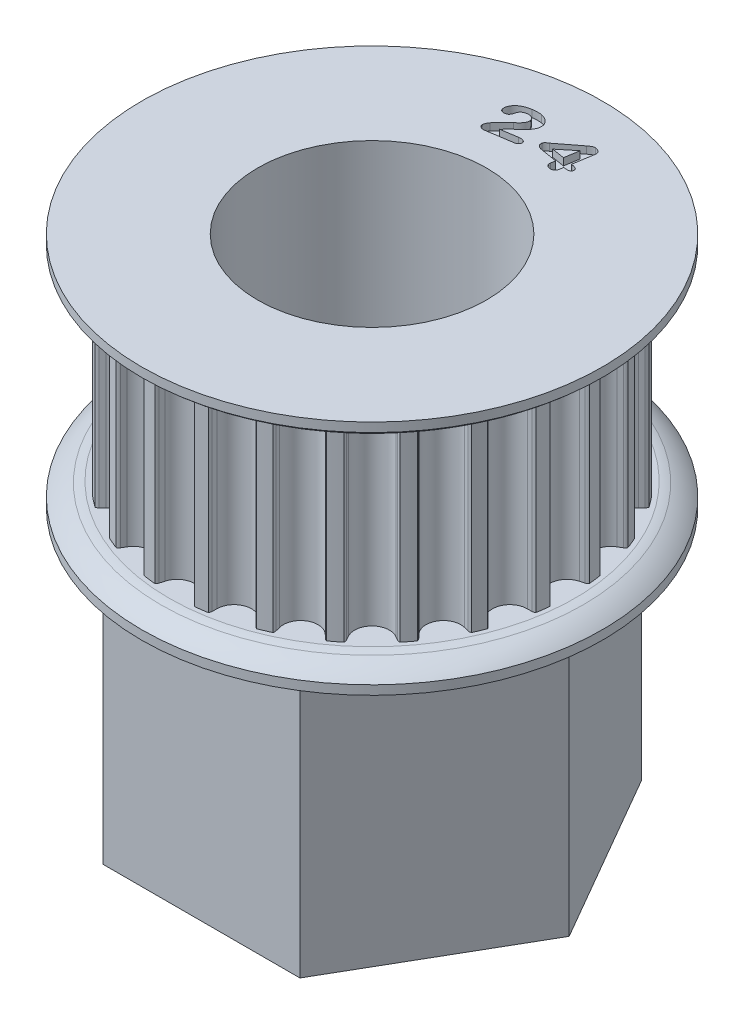
from build123d import *

# Parameters (mm, degrees)
SKETCH1_R                    = 11.078156269
TOOTHOD_DEPTH                = 5.334
TOOTHPROFILE_DEPTH           = 17.550004491
TOOTHPATTERN_COUNT           = 24
BORE_DEPTH                   = 20.343586122
BORE_DEPTH_BACK              = 20.343586122
SKETCH7_R                    = 6.3881
SMALL_TOOTH_COUNT_DEPTH      = 23.472489227
SMALL_TOOTH_COUNT_DEPTH_BACK = 0.4
SKETCH12_R                   = 6.3881
BOSS_EXTRUDE1_DEPTH          = 15.24


with BuildPart() as part:
    # Sketch1 → ToothOD (new, symmetric)
    with BuildSketch(Plane(origin=(0, 0, 0), x_dir=(1, 0, 0), z_dir=(0, 1, 0))):
        Circle(SKETCH1_R)
    extrude(amount=TOOTHOD_DEPTH, both=True)

    # Sketch2 → ToothProfile (cut, symmetric)
    with BuildSketch(Plane(origin=(0, 0, 0), x_dir=(1, 0, 0), z_dir=(0, 1, 0))):
        with BuildLine():
            ThreePointArc((-0.937033068, 10.628218265), (-0.590385173, 10.110043655), (0, 9.909756269))
            ThreePointArc((0, 9.909756269), (0.590385173, 10.110043655), (0.937033068, 10.628218265))
            ThreePointArc((0.937033068, 10.628218265), (0.971699064, 10.754329727), (1.007805813, 10.880036269))
            ThreePointArc((1.007805813, 10.880036269), (1.043742495, 10.958436311), (1.100516181, 11.023357495))
            ThreePointArc((1.100516181, 11.023357495), (0, 11.078156269), (-1.100516181, 11.023357495))
            ThreePointArc((-1.100516181, 11.023357495), (-1.043742495, 10.958436311), (-1.007805813, 10.880036269))
            ThreePointArc((-1.007805813, 10.880036269), (-0.971699064, 10.754329727), (-0.937033068, 10.628218265))
        make_face()
    toothprofile = extrude(amount=TOOTHPROFILE_DEPTH, both=True, mode=Mode.SUBTRACT)

    # ToothPattern: ToothProfile ×24 about axis
    toothpattern_axis = Axis((0, 5.334, 0), (0, -1, 0))
    for i in range(1, TOOTHPATTERN_COUNT):
        add(toothprofile.rotate(toothpattern_axis, i * 360 / TOOTHPATTERN_COUNT), mode=Mode.SUBTRACT)

    # Sketch4 → Flange (revolve)
    with BuildSketch(Plane.XY):
        with BuildLine():
            Line((0, -5.334), (11.332156269, -5.334))
            ThreePointArc((11.332156269, -5.334), (11.56180289, -5.369951298), (11.787228598, -5.426637424))
            ThreePointArc((11.787228598, -5.426637424), (12.354957174, -5.708197125), (12.856156269, -6.096))
            Line((12.856156269, -6.096), (12.856156269, -6.604))
            Line((12.856156269, -6.604), (0, -6.604))
            Line((0, -6.604), (0, -5.334))
        make_face()
        with BuildLine():
            Line((12.856156269, 6.604), (12.856156269, 6.096))
            ThreePointArc((12.856156269, 6.096), (12.354957174, 5.708197125), (11.787228598, 5.426637424))
            ThreePointArc((11.787228598, 5.426637424), (11.56180289, 5.369951298), (11.332156269, 5.334))
            Line((11.332156269, 5.334), (0, 5.334))
            Line((0, 5.334), (0, 6.604))
            Line((0, 6.604), (12.856156269, 6.604))
        make_face()
    revolve(axis=Axis((0, 8.73125, 0), (0, -1, 0)))

    # Sketch7 → Bore (cut, two sides: drawn at the far end of the back side and taken through both)
    with BuildSketch(Plane.XZ.offset(-BORE_DEPTH_BACK)):
        Circle(SKETCH7_R)
    extrude(amount=BORE_DEPTH + BORE_DEPTH_BACK, mode=Mode.SUBTRACT)

    # Sketch11 → Small Tooth Count (cut, two sides: drawn at the far end of the back side and taken through both)
    # profile 1 of 2: a face of its own
    with BuildSketch(Plane(origin=(0, 6.604, 0), x_dir=(1, 0, 0), z_dir=(0, 1, 0)).offset(-SMALL_TOOTH_COUNT_DEPTH_BACK)):
        with BuildLine():
            Line((-1.506669992, 8.621605484), (-0.594948898, 8.761801578))
            add(Edge.make_bspline(
                [(-0.594948898, 8.761801578), (-0.568508634, 8.765198423), (-0.51843609, 8.771631365), (-0.44654772, 8.772071074), (-0.382615431, 8.763265759), (-0.327096583, 8.746782768), (-0.28073736, 8.722976742), (-0.245229797, 8.692438756), (-0.219549143, 8.656177692), (-0.213233627, 8.628356784), (-0.210079367, 8.614461734)],
                knots=[0, 0, 0, 0, 1.405872796, 2.662440438, 3.780874982, 4.799416848, 5.705812893, 6.507413553, 7.254533237, 8, 8, 8, 8], degree=3))
            add(Edge.make_bspline(
                [(-0.210079367, 8.614461734), (-0.208889964, 8.601771408), (-0.206493047, 8.576197502), (-0.216741472, 8.537560395), (-0.235628299, 8.499855984), (-0.26391302, 8.463095811), (-0.302942444, 8.429662764), (-0.353193783, 8.402600281), (-0.413829448, 8.381641212), (-0.458320193, 8.373612775), (-0.481988351, 8.369341812)],
                knots=[0, 0, 0, 0, 0.747692017, 1.506770081, 2.320581731, 3.22962232, 4.226992794, 5.332726267, 6.581065457, 8, 8, 8, 8], degree=3))
            Line((-0.481988351, 8.369341812), (-1.850909445, 8.159494156))
            add(Edge.make_bspline(
                [(-1.850909445, 8.159494156), (-1.874677499, 8.156558384), (-1.920064022, 8.15095235), (-1.985993536, 8.153953423), (-2.045566646, 8.166819623), (-2.097937256, 8.188882133), (-2.141644576, 8.218958806), (-2.176056266, 8.25450227), (-2.200261447, 8.296079566), (-2.206948594, 8.326650658), (-2.210329367, 8.342106266)],
                knots=[0, 0, 0, 0, 1.280086864, 2.444402485, 3.513161164, 4.526674079, 5.465738593, 6.33344229, 7.157450346, 8, 8, 8, 8], degree=3))
            add(Edge.make_bspline(
                [(-2.210329367, 8.342106266), (-2.211321429, 8.35297506), (-2.213474856, 8.376567494), (-2.207871102, 8.414736071), (-2.197602748, 8.457816322), (-2.181066772, 8.504044131), (-2.161523691, 8.550563815), (-2.139011673, 8.59387946), (-2.114771053, 8.632517333), (-2.096113828, 8.655263986), (-2.087099679, 8.666253922)],
                knots=[0, 0, 0, 0, 0.73683643, 1.599419737, 2.594339727, 3.735396803, 4.918497864, 6.009402824, 7.038252518, 8, 8, 8, 8], degree=3))
            add(Edge.make_bspline(
                [(-2.087099679, 8.666253922), (-2.051926797, 8.70563464), (-1.983635312, 8.782096037), (-1.882781696, 8.891706347), (-1.787421488, 8.993402689), (-1.71040015, 9.071642309), (-1.653062288, 9.130098592), (-1.613191617, 9.168811361), (-1.576609875, 9.204115545), (-1.543103636, 9.235957396), (-1.512499045, 9.26401221), (-1.484693768, 9.288140763), (-1.460222689, 9.308797929), (-1.444641349, 9.320989249), (-1.437464914, 9.326604312)],
                knots=[0, 0, 0, 0, 2.05005439, 3.980374895, 5.783081705, 7.462550166, 8.242986023, 8.962167681, 9.620127169, 10.216906376, 10.75681469, 11.231916014, 11.646236775, 12, 12, 12, 12], degree=3))
            add(Edge.make_bspline(
                [(-1.437464914, 9.326604312), (-1.415699138, 9.344096052), (-1.373639167, 9.377896918), (-1.31556485, 9.430556423), (-1.263091792, 9.481497265), (-1.217417118, 9.532268382), (-1.177355276, 9.581870506), (-1.143339078, 9.630659742), (-1.115770383, 9.678955907), (-1.094008941, 9.726222335), (-1.079010073, 9.772608594), (-1.068990971, 9.817254636), (-1.066125276, 9.860516575), (-1.069031756, 9.888447706), (-1.070454757, 9.902122672)],
                knots=[0, 0, 0, 0, 1.412730359, 2.729946272, 3.965505171, 5.111982469, 6.183504339, 7.190458038, 8.118071664, 8.994433913, 9.818491729, 10.580687815, 11.305110666, 12, 12, 12, 12], degree=3))
            add(Edge.make_bspline(
                [(-1.070454757, 9.902122672), (-1.073101852, 9.915947961), (-1.078327528, 9.943240708), (-1.094494112, 9.981703166), (-1.116615509, 10.017043528), (-1.145060228, 10.04859137), (-1.178300901, 10.076950508), (-1.216302468, 10.101048218), (-1.258889714, 10.120303405), (-1.305215474, 10.134908931), (-1.354364351, 10.144457895), (-1.405333989, 10.149506523), (-1.457750016, 10.149178642), (-1.492860178, 10.144637273), (-1.510688351, 10.142331266)],
                knots=[0, 0, 0, 0, 0.907302037, 1.791120925, 2.676768316, 3.589403735, 4.523810352, 5.492033175, 6.485886253, 7.534944553, 8.622934081, 9.714528692, 10.839487572, 12, 12, 12, 12], degree=3))
            add(Edge.make_bspline(
                [(-1.510688351, 10.142331266), (-1.527596498, 10.139296406), (-1.560826651, 10.133331894), (-1.608260799, 10.117909964), (-1.652483903, 10.098012849), (-1.693864274, 10.074084955), (-1.731680005, 10.044484021), (-1.76651825, 10.010598615), (-1.798089169, 9.971893058), (-1.815934823, 9.943404547), (-1.825013351, 9.928911734)],
                knots=[0, 0, 0, 0, 1.046472807, 2.056668438, 3.031518194, 3.999586305, 4.963434377, 5.951707826, 6.95798289, 8, 8, 8, 8], degree=3))
            add(Edge.make_bspline(
                [(-1.825013351, 9.928911734), (-1.826559277, 9.925360904), (-1.831340104, 9.91437984), (-1.837656207, 9.890979564), (-1.847717966, 9.855611617), (-1.859566069, 9.81054411), (-1.873864818, 9.760908096), (-1.893574508, 9.713288417), (-1.916666393, 9.669565796), (-1.942422798, 9.628901741), (-1.976575179, 9.593383256), (-2.021136356, 9.565627073), (-2.075687033, 9.545210856), (-2.115811032, 9.537738725), (-2.137105929, 9.533773062)],
                knots=[0, 0, 0, 0, 0.255611913, 0.790488512, 1.596709105, 2.686601655, 3.868395343, 5.00580505, 6.083210694, 7.132990612, 8.175842434, 9.3076298, 10.571085967, 12, 12, 12, 12], degree=3))
            add(Edge.make_bspline(
                [(-2.137105929, 9.533773062), (-2.153754851, 9.531867902), (-2.186007077, 9.528177233), (-2.23368108, 9.532108784), (-2.278463536, 9.542658983), (-2.31955032, 9.560810626), (-2.355603746, 9.586270992), (-2.383667544, 9.619490715), (-2.403753934, 9.659477168), (-2.40984827, 9.688934956), (-2.413033273, 9.704330094)],
                knots=[0, 0, 0, 0, 1.103119517, 2.136958887, 3.137057405, 4.125913058, 5.082313969, 6.022605602, 6.966580255, 8, 8, 8, 8], degree=3))
            add(Edge.make_bspline(
                [(-2.413033273, 9.704330094), (-2.415009696, 9.722614032), (-2.419038371, 9.759883408), (-2.41588734, 9.817423499), (-2.405366179, 9.876857396), (-2.387446287, 9.937809803), (-2.362210558, 9.998975276), (-2.32919863, 10.0590732), (-2.288238244, 10.117088054), (-2.239926945, 10.173568432), (-2.18329972, 10.227352379), (-2.118289715, 10.277709516), (-2.044964572, 10.324806196), (-1.963139928, 10.367987482), (-1.872740102, 10.406840276), (-1.773817701, 10.440289158), (-1.666292684, 10.467537519), (-1.591307924, 10.480391675), (-1.552657882, 10.487017203)],
                knots=[0, 0, 0, 0, 0.686274673, 1.398879655, 2.144007501, 2.9376906, 3.768012583, 4.611728168, 5.494195759, 6.417073659, 7.384708564, 8.407017315, 9.485272479, 10.637082362, 11.860187496, 13.158039043, 14.535143527, 16, 16, 16, 16], degree=3))
            add(Edge.make_bspline(
                [(-1.552657882, 10.487017203), (-1.52841577, 10.490420955), (-1.480751914, 10.497113273), (-1.410338577, 10.504749177), (-1.342432419, 10.509701208), (-1.277046262, 10.51204123), (-1.214045238, 10.511479586), (-1.153411338, 10.508973664), (-1.095114995, 10.503782012), (-1.05733219, 10.497930911), (-1.038754367, 10.495053922)],
                knots=[0, 0, 0, 0, 1.138402681, 2.238281105, 3.293071229, 4.304174642, 5.280103653, 6.222317189, 7.125912474, 8, 8, 8, 8], degree=3))
            add(Edge.make_bspline(
                [(-1.038754367, 10.495053922), (-1.012752892, 10.489369266), (-0.96200432, 10.478274198), (-0.888985545, 10.45489373), (-0.821106831, 10.425791147), (-0.75796727, 10.391965838), (-0.700394534, 10.353338936), (-0.647860502, 10.311763872), (-0.60189878, 10.265513926), (-0.561703519, 10.21630272), (-0.52825955, 10.16388857), (-0.500935533, 10.109658948), (-0.481526714, 10.052937679), (-0.474093975, 10.014001671), (-0.470379757, 9.994544937)],
                knots=[0, 0, 0, 0, 1.187267261, 2.317257711, 3.41519456, 4.479015239, 5.508703171, 6.505479901, 7.463513324, 8.412595886, 9.335595681, 10.232590248, 11.116806744, 12, 12, 12, 12], degree=3))
            add(Edge.make_bspline(
                [(-0.470379757, 9.994544937), (-0.468313859, 9.979241775), (-0.464214985, 9.948879331), (-0.463028656, 9.902976173), (-0.465763305, 9.85759698), (-0.472017419, 9.812321869), (-0.482311465, 9.767549639), (-0.496288954, 9.722898988), (-0.514091815, 9.678640488), (-0.543276505, 9.621627388), (-0.5821308, 9.554514276), (-0.631232404, 9.480877647), (-0.681592679, 9.416301746), (-0.726197052, 9.368271741), (-0.764793863, 9.33139352), (-0.797639899, 9.300077015), (-0.835761225, 9.26560612), (-0.877842806, 9.226250562), (-0.924928843, 9.183462306), (-0.976268817, 9.136246595), (-1.032855305, 9.085860231), (-1.092257956, 9.032453687), (-1.15175781, 8.978868961), (-1.207750431, 8.927106786), (-1.258421687, 8.87803841), (-1.304564576, 8.832351062), (-1.346165344, 8.790274212), (-1.382469769, 8.750659594), (-1.414153642, 8.714540455), (-1.432796387, 8.690739083), (-1.441483273, 8.679648453)],
                knots=[0, 0, 0, 0, 0.765164555, 1.518135043, 2.272081093, 3.017164573, 3.78151037, 4.54699507, 5.334877641, 6.143361033, 7.720335075, 9.177470953, 10.528127201, 11.776029629, 12.423102498, 13.17473405, 14.025995043, 14.971095859, 16.031319452, 17.180387881, 18.429249831, 19.78780431, 21.140877121, 22.399207521, 23.568147666, 24.637778838, 25.618752723, 26.501291816, 27.301652942, 28, 28, 28, 28], degree=3))
            add(Edge.make_bspline(
                [(-1.441483273, 8.679648453), (-1.451024119, 8.669362064), (-1.470895109, 8.64793831), (-1.494433375, 8.630612493), (-1.506669992, 8.621605484)],
                knots=[0, 0, 0, 0, 0.960278846, 2, 2, 2, 2], degree=3))
        make_face()
    # profile 2 of 2: a face of its own
    with BuildSketch(Plane(origin=(0, 6.604, 0), x_dir=(1, 0, 0), z_dir=(0, 1, 0)).offset(-SMALL_TOOTH_COUNT_DEPTH_BACK)):
        with BuildLine():
            Line((1.55101935, 8.418337433), (1.58986349, 8.657206573))
            Line((1.58986349, 8.657206573), (0.687072084, 8.804099933))
            add(Edge.make_bspline(
                [(0.687072084, 8.804099933), (0.672000892, 8.806741232), (0.642738196, 8.811869661), (0.600810489, 8.822399788), (0.561659252, 8.833606125), (0.526052232, 8.847723884), (0.49325817, 8.862566946), (0.463946389, 8.879844481), (0.437487068, 8.898471155), (0.414229874, 8.918944931), (0.394394887, 8.941043653), (0.3777235, 8.964388587), (0.364276625, 8.988924673), (0.354172911, 9.014710713), (0.348258344, 9.041703291), (0.344382255, 9.06962205), (0.344406118, 9.09891493), (0.347202432, 9.118597173), (0.348636928, 9.128694073)],
                knots=[0, 0, 0, 0, 1.38782965, 2.694653257, 3.920845065, 5.079439636, 6.166911603, 7.183666584, 8.161659764, 9.099192842, 9.988512293, 10.850339669, 11.696364112, 12.521436542, 13.353442013, 14.197632313, 15.075393629, 16, 16, 16, 16], degree=3))
            add(Edge.make_bspline(
                [(0.348636928, 9.128694073), (0.351090473, 9.140034839), (0.356004071, 9.162746447), (0.37336919, 9.194608637), (0.397597542, 9.224376541), (0.427253538, 9.253217688), (0.460197633, 9.280208705), (0.493160259, 9.30650456), (0.526830527, 9.330042268), (0.551301349, 9.341407655), (0.563395912, 9.347024933)],
                knots=[0, 0, 0, 0, 0.877242126, 1.756810773, 2.722289886, 3.785183681, 4.892166321, 5.954759652, 6.989151789, 8, 8, 8, 8], degree=3))
            Line((0.563395912, 9.347024933), (1.726934193, 10.244012042))
            add(Edge.make_bspline(
                [(1.726934193, 10.244012042), (1.745455489, 10.257963538), (1.780367267, 10.284261458), (1.830792076, 10.319655435), (1.875735016, 10.348586491), (1.915975089, 10.372543351), (1.955715965, 10.388864789), (1.997117102, 10.398536139), (2.041252917, 10.400673528), (2.071056423, 10.396874001), (2.086354115, 10.394923761)],
                knots=[0, 0, 0, 0, 1.380525043, 2.602225324, 3.666482481, 4.563308915, 5.38602964, 6.213555657, 7.083044891, 8, 8, 8, 8], degree=3))
            add(Edge.make_bspline(
                [(2.086354115, 10.394923761), (2.099950722, 10.392636805), (2.126158697, 10.388228611), (2.163530831, 10.37784315), (2.198177308, 10.367161507), (2.229931127, 10.354127612), (2.258285181, 10.338868891), (2.284274792, 10.322533926), (2.306434796, 10.303430926), (2.326623159, 10.283439947), (2.343027156, 10.260768158), (2.357095196, 10.236647038), (2.36772325, 10.210618693), (2.375523933, 10.182922916), (2.379710956, 10.153359512), (2.3815777, 10.121992701), (2.380223715, 10.088784623), (2.376927183, 10.066288119), (2.375229506, 10.054702667)],
                knots=[0, 0, 0, 0, 1.293718347, 2.49369126, 3.638355781, 4.697226892, 5.709998889, 6.659676699, 7.572229335, 8.451761542, 9.321019532, 10.191175747, 11.068373351, 11.953329014, 12.886200711, 13.866040933, 14.90103448, 16, 16, 16, 16], degree=3))
            Line((2.375229506, 10.054702667), (2.193510365, 8.940277667))
            Line((2.193510365, 8.940277667), (2.216281068, 8.936705792))
            add(Edge.make_bspline(
                [(2.216281068, 8.936705792), (2.241193074, 8.932091848), (2.288965188, 8.923243991), (2.357158875, 8.905696845), (2.418091811, 8.882988992), (2.464944242, 8.862355753), (2.49722756, 8.842401913), (2.517904876, 8.826459131), (2.53406144, 8.807761472), (2.546929047, 8.787559106), (2.555370678, 8.765194718), (2.560413445, 8.74125672), (2.561168806, 8.715455659), (2.558976977, 8.697966373), (2.557841615, 8.688906964)],
                knots=[0, 0, 0, 0, 1.927900532, 3.697008064, 5.348680627, 6.873734726, 7.580819258, 8.233476042, 8.851406833, 9.451648706, 10.046847793, 10.659881323, 11.305821727, 12, 12, 12, 12], degree=3))
            add(Edge.make_bspline(
                [(2.557841615, 8.688906964), (2.554520452, 8.67473757), (2.548041087, 8.647094043), (2.523852738, 8.611284281), (2.489399567, 8.583576013), (2.445267354, 8.563875927), (2.392370456, 8.551964631), (2.331419439, 8.546892728), (2.262560581, 8.549495369), (2.21444511, 8.556287496), (2.189045521, 8.559872979)],
                knots=[0, 0, 0, 0, 0.798462296, 1.557745882, 2.33458468, 3.213665066, 4.202693499, 5.316916844, 6.583632097, 8, 8, 8, 8], degree=3))
            Line((2.189045521, 8.559872979), (2.13278849, 8.568802667))
            Line((2.13278849, 8.568802667), (2.09394435, 8.329933526))
            add(Edge.make_bspline(
                [(2.09394435, 8.329933526), (2.090019799, 8.31187243), (2.082483489, 8.277189727), (2.06035015, 8.229811046), (2.028427267, 8.190889739), (1.988767083, 8.159652081), (1.941441543, 8.137876464), (1.88844883, 8.124793342), (1.829599126, 8.12203693), (1.789250213, 8.126901407), (1.768010756, 8.129462042)],
                knots=[0, 0, 0, 0, 1.024724911, 1.967778121, 2.872957572, 3.797526721, 4.748052707, 5.744674447, 6.812808394, 8, 8, 8, 8], degree=3))
            add(Edge.make_bspline(
                [(1.768010756, 8.129462042), (1.74999432, 8.133208829), (1.715228917, 8.140438813), (1.667113738, 8.160244967), (1.625751617, 8.187418032), (1.591227716, 8.221249557), (1.564518328, 8.261748455), (1.549514744, 8.309505798), (1.544018398, 8.362576467), (1.548612232, 8.399165297), (1.55101935, 8.418337433)],
                knots=[0, 0, 0, 0, 1.077478031, 2.079154688, 3.030478112, 3.96238638, 4.896865886, 5.843533801, 6.870035992, 8, 8, 8, 8], degree=3))
        make_face()
        Polygon((0.938442787, 9.144321026), (1.650585365, 9.028681573), (1.780958803, 9.828781573), align=None, mode=Mode.SUBTRACT)
    extrude(amount=SMALL_TOOTH_COUNT_DEPTH + SMALL_TOOTH_COUNT_DEPTH_BACK, mode=Mode.SUBTRACT)

    # Sketch12 → Boss-Extrude1 (add)
    with BuildSketch(Plane.XZ.offset(6.604)):
        Polygon((5.499261314, -9.525), (10.998522628, 0), (5.499261314, 9.525), (-5.499261314, 9.525), (-10.998522628, 0), (-5.499261314, -9.525), align=None)
        Circle(SKETCH12_R, mode=Mode.SUBTRACT)
    extrude(amount=BOSS_EXTRUDE1_DEPTH)


solid = part.part
